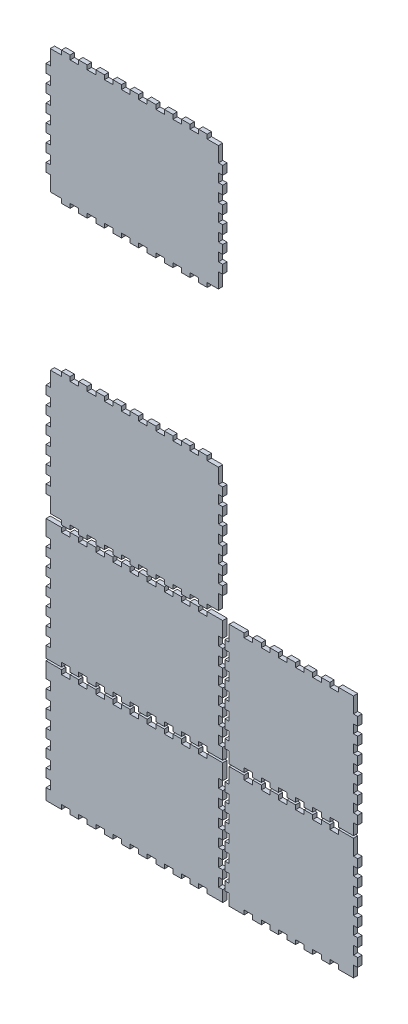
from build123d import *

# Parameters (mm, degrees)
P_IDAT_VYSUNUT_M1_DEPTH   = 4
P_IDAT_VYSUNUT_M1_2_DEPTH = 4
P_IDAT_VYSUNUT_M1_3_DEPTH = 4
P_IDAT_VYSUNUT_M1_4_DEPTH = 4
P_IDAT_VYSUNUT_M1_5_DEPTH = 4
P_IDAT_VYSUNUT_M1_6_DEPTH = 4


with BuildPart() as part:
    # Model → Přidat vysunutím1 (new body)
    with BuildSketch(Plane.XY):
        Polygon((13.9995, 22.0004), (24.5001, 22.0004), (24.5001, 25.9994), (32.4997, 25.9994), (32.4997, 22.0004), (40.5007, 22.0004), (40.5007, 25.9994), (48.4999, 25.9994), (48.4999, 22.0004), (56.4995, 22.0004), (56.4995, 25.9994), (64.5005, 25.9994), (64.5005, 22.0004), (72.5001, 22.0004), (72.5001, 25.9994), (80.4997, 25.9994), (80.4997, 22.0004), (88.5003, 22.0004), (88.5003, 25.9994), (96.4999, 25.9994), (96.4999, 22.0004), (104.499, 22.0004), (104.499, 25.9994), (112.5, 25.9994), (112.5, 22.0004), (120.5, 22.0004), (120.5, 25.9994), (128.501, 25.9994), (128.501, 22.0004), (136.5, 22.0004), (136.5, 25.9994), (144.5, 25.9994), (144.5, 22.0004), (152.499, 22.0004), (152.499, 25.9994), (160.5, 25.9994), (160.5, 22.0004), (171, 22.0004), (175, 22.0004), (175, 32.4997), (171, 32.4997), (171, 40.5007), (175, 40.5007), (175, 48.4999), (171, 48.4999), (171, 56.4995), (175, 56.4995), (175, 64.5005), (171, 64.5005), (171, 72.5001), (175, 72.5001), (175, 80.4997), (171, 80.4997), (171, 88.5003), (175, 88.5003), (175, 96.4999), (171, 96.4999), (171, 104.499), (175, 104.499), (175, 112.5), (171, 112.5), (171, 120.5), (175, 120.5), (175, 131), (175, 135), (171, 135), (160.5, 135), (160.5, 131), (152.499, 131), (152.499, 135), (144.5, 135), (144.5, 131), (136.5, 131), (136.5, 135), (128.501, 135), (128.501, 131), (120.5, 131), (120.5, 135), (112.5, 135), (112.5, 131), (104.499, 131), (104.499, 135), (96.4999, 135), (96.4999, 131), (88.5003, 131), (88.5003, 135), (80.4997, 135), (80.4997, 131), (72.5001, 131), (72.5001, 135), (64.5005, 135), (64.5005, 131), (56.4995, 131), (56.4995, 135), (48.4999, 135), (48.4999, 131), (40.5007, 131), (40.5007, 135), (32.4997, 135), (32.4997, 131), (24.5001, 131), (24.5001, 135), (13.9995, 135), (10.0004, 135), (10.0004, 131), (10.0004, 120.5), (13.9995, 120.5), (13.9995, 112.5), (10.0004, 112.5), (10.0004, 104.499), (13.9995, 104.499), (13.9995, 96.4999), (10.0004, 96.4999), (10.0004, 88.5003), (13.9995, 88.5003), (13.9995, 80.4997), (10.0004, 80.4997), (10.0004, 72.5001), (13.9995, 72.5001), (13.9995, 64.5005), (10.0004, 64.5005), (10.0004, 56.4995), (13.9995, 56.4995), (13.9995, 48.4999), (10.0004, 48.4999), (10.0004, 40.5007), (13.9995, 40.5007), (13.9995, 32.4997), (10.0004, 32.4997), (10.0004, 22.0004), align=None)
    extrude(amount=P_IDAT_VYSUNUT_M1_DEPTH)


with BuildPart() as body_2:
    # Model → P_idat vysunut_m1 2 (new body)
    with BuildSketch(Plane.XY):
        Polygon((13.9995, 137.001), (24.5001, 137.001), (24.5001, 141), (32.4997, 141), (32.4997, 137.001), (40.5007, 137.001), (40.5007, 141), (48.4999, 141), (48.4999, 137.001), (56.4995, 137.001), (56.4995, 141), (64.5005, 141), (64.5005, 137.001), (72.5001, 137.001), (72.5001, 141), (80.4997, 141), (80.4997, 137.001), (88.5003, 137.001), (88.5003, 141), (96.4999, 141), (96.4999, 137.001), (104.499, 137.001), (104.499, 141), (112.5, 141), (112.5, 137.001), (120.5, 137.001), (120.5, 141), (128.501, 141), (128.501, 137.001), (136.5, 137.001), (136.5, 141), (144.5, 141), (144.5, 137.001), (152.499, 137.001), (152.499, 141), (160.5, 141), (160.5, 137.001), (171, 137.001), (175, 137.001), (175, 147.5), (171, 147.5), (171, 155.499), (175, 155.499), (175, 163.5), (171, 163.5), (171, 171.5), (175, 171.5), (175, 179.5), (171, 179.5), (171, 187.5), (175, 187.5), (175, 195.5), (171, 195.5), (171, 203.501), (175, 203.501), (175, 211.5), (171, 211.5), (171, 219.499), (175, 219.499), (175, 227.5), (171, 227.5), (171, 235.5), (175, 235.5), (175, 246), (175, 249.999), (171, 249.999), (160.5, 249.999), (160.5, 246), (152.499, 246), (152.499, 249.999), (144.5, 249.999), (144.5, 246), (136.5, 246), (136.5, 249.999), (128.501, 249.999), (128.501, 246), (120.5, 246), (120.5, 249.999), (112.5, 249.999), (112.5, 246), (104.499, 246), (104.499, 249.999), (96.4999, 249.999), (96.4999, 246), (88.5003, 246), (88.5003, 249.999), (80.4997, 249.999), (80.4997, 246), (72.5001, 246), (72.5001, 249.999), (64.5005, 249.999), (64.5005, 246), (56.4995, 246), (56.4995, 249.999), (48.4999, 249.999), (48.4999, 246), (40.5007, 246), (40.5007, 249.999), (32.4997, 249.999), (32.4997, 246), (24.5001, 246), (24.5001, 249.999), (13.9995, 249.999), (10.0004, 249.999), (10.0004, 246), (10.0004, 235.5), (13.9995, 235.5), (13.9995, 227.5), (10.0004, 227.5), (10.0004, 219.499), (13.9995, 219.499), (13.9995, 211.5), (10.0004, 211.5), (10.0004, 203.501), (13.9995, 203.501), (13.9995, 195.5), (10.0004, 195.5), (10.0004, 187.5), (13.9995, 187.5), (13.9995, 179.5), (10.0004, 179.5), (10.0004, 171.5), (13.9995, 171.5), (13.9995, 163.5), (10.0004, 163.5), (10.0004, 155.499), (13.9995, 155.499), (13.9995, 147.5), (10.0004, 147.5), (10.0004, 137.001), align=None)
    extrude(amount=P_IDAT_VYSUNUT_M1_2_DEPTH)


with BuildPart() as body_3:
    # Model → P_idat vysunut_m1 3 (new body)
    with BuildSketch(Plane.XY):
        Polygon((13.9995, 256), (24.5001, 256), (24.5001, 252), (32.4997, 252), (32.4997, 256), (40.5007, 256), (40.5007, 252), (48.4999, 252), (48.4999, 256), (56.4995, 256), (56.4995, 252), (64.5005, 252), (64.5005, 256), (72.5001, 256), (72.5001, 252), (80.4997, 252), (80.4997, 256), (88.5003, 256), (88.5003, 252), (96.4999, 252), (96.4999, 256), (104.499, 256), (104.499, 252), (112.5, 252), (112.5, 256), (120.5, 256), (120.5, 252), (128.501, 252), (128.501, 256), (136.5, 256), (136.5, 252), (144.5, 252), (144.5, 256), (152.499, 256), (152.499, 252), (160.5, 252), (160.5, 256), (171, 256), (171, 270), (175, 270), (175, 278), (171, 278), (171, 285.999), (175, 285.999), (175, 294), (171, 294), (171, 302), (175, 302), (175, 309.999), (171, 309.999), (171, 318), (175, 318), (175, 326), (171, 326), (171, 334), (175, 334), (175, 342), (171, 342), (171, 350), (175, 350), (175, 357.999), (171, 357.999), (171, 372.001), (160.5, 372.001), (160.5, 376.001), (152.499, 376.001), (152.499, 372.001), (144.5, 372.001), (144.5, 376.001), (136.5, 376.001), (136.5, 372.001), (128.501, 372.001), (128.501, 376.001), (120.5, 376.001), (120.5, 372.001), (112.5, 372.001), (112.5, 376.001), (104.499, 376.001), (104.499, 372.001), (96.4999, 372.001), (96.4999, 376.001), (88.5003, 376.001), (88.5003, 372.001), (80.4997, 372.001), (80.4997, 376.001), (72.5001, 376.001), (72.5001, 372.001), (64.5005, 372.001), (64.5005, 376.001), (56.4995, 376.001), (56.4995, 372.001), (48.4999, 372.001), (48.4999, 376.001), (40.5007, 376.001), (40.5007, 372.001), (32.4997, 372.001), (32.4997, 376.001), (24.5001, 376.001), (24.5001, 372.001), (13.9995, 372.001), (13.9995, 357.999), (10.0004, 357.999), (10.0004, 350), (13.9995, 350), (13.9995, 342), (10.0004, 342), (10.0004, 334), (13.9995, 334), (13.9995, 326), (10.0004, 326), (10.0004, 318), (13.9995, 318), (13.9995, 309.999), (10.0004, 309.999), (10.0004, 302), (13.9995, 302), (13.9995, 294), (10.0004, 294), (10.0004, 285.999), (13.9995, 285.999), (13.9995, 278), (10.0004, 278), (10.0004, 270), (13.9995, 270), align=None)
    extrude(amount=P_IDAT_VYSUNUT_M1_3_DEPTH)


with BuildPart() as body_4:
    # Model → P_idat vysunut_m1 4 (new body)
    with BuildSketch(Plane.XY):
        Polygon((13.9995, 516.001), (24.5001, 516.001), (24.5001, 512), (32.4997, 512), (32.4997, 516.001), (40.5007, 516.001), (40.5007, 512), (48.4999, 512), (48.4999, 516.001), (56.4995, 516.001), (56.4995, 512), (64.5005, 512), (64.5005, 516.001), (72.5001, 516.001), (72.5001, 512), (80.4997, 512), (80.4997, 516.001), (88.5003, 516.001), (88.5003, 512), (96.4999, 512), (96.4999, 516.001), (104.499, 516.001), (104.499, 512), (112.5, 512), (112.5, 516.001), (120.5, 516.001), (120.5, 512), (128.501, 512), (128.501, 516.001), (136.5, 516.001), (136.5, 512), (144.5, 512), (144.5, 516.001), (152.499, 516.001), (152.499, 512), (160.5, 512), (160.5, 516.001), (171, 516.001), (171, 529.999), (175, 529.999), (175, 538), (171, 538), (171, 546.001), (175, 546.001), (175, 553.999), (171, 553.999), (171, 562), (175, 562), (175, 570.001), (171, 570.001), (171, 578.002), (175, 578.002), (175, 585.999), (171, 585.999), (171, 594), (175, 594), (175, 602.001), (171, 602.001), (171, 609.999), (175, 609.999), (175, 618), (171, 618), (171, 632.001), (160.5, 632.001), (160.5, 636.002), (152.499, 636.002), (152.499, 632.001), (144.5, 632.001), (144.5, 636.002), (136.5, 636.002), (136.5, 632.001), (128.501, 632.001), (128.501, 636.002), (120.5, 636.002), (120.5, 632.001), (112.5, 632.001), (112.5, 636.002), (104.499, 636.002), (104.499, 632.001), (96.4999, 632.001), (96.4999, 636.002), (88.5003, 636.002), (88.5003, 632.001), (80.4997, 632.001), (80.4997, 636.002), (72.5001, 636.002), (72.5001, 632.001), (64.5005, 632.001), (64.5005, 636.002), (56.4995, 636.002), (56.4995, 632.001), (48.4999, 632.001), (48.4999, 636.002), (40.5007, 636.002), (40.5007, 632.001), (32.4997, 632.001), (32.4997, 636.002), (24.5001, 636.002), (24.5001, 632.001), (13.9995, 632.001), (13.9995, 618), (10.0004, 618), (10.0004, 609.999), (13.9995, 609.999), (13.9995, 602.001), (10.0004, 602.001), (10.0004, 594), (13.9995, 594), (13.9995, 585.999), (10.0004, 585.999), (10.0004, 578.002), (13.9995, 578.002), (13.9995, 570.001), (10.0004, 570.001), (10.0004, 562), (13.9995, 562), (13.9995, 553.999), (10.0004, 553.999), (10.0004, 546.001), (13.9995, 546.001), (13.9995, 538), (10.0004, 538), (10.0004, 529.999), (13.9995, 529.999), align=None)
    extrude(amount=P_IDAT_VYSUNUT_M1_4_DEPTH)


with BuildPart() as body_5:
    # Model → P_idat vysunut_m1 5 (new body)
    with BuildSketch(Plane.XY):
        Polygon((181, 22.0004), (195.001, 22.0004), (195.001, 25.9994), (203, 25.9994), (203, 22.0004), (211, 22.0004), (211, 25.9994), (218.999, 25.9994), (218.999, 22.0004), (227, 22.0004), (227, 25.9994), (235, 25.9994), (235, 22.0004), (243, 22.0004), (243, 25.9994), (251, 25.9994), (251, 22.0004), (259, 22.0004), (259, 25.9994), (267.001, 25.9994), (267.001, 22.0004), (275, 22.0004), (275, 25.9994), (282.999, 25.9994), (282.999, 22.0004), (297, 22.0004), (297, 32.4997), (301, 32.4997), (301, 40.5007), (297, 40.5007), (297, 48.4999), (301, 48.4999), (301, 56.4995), (297, 56.4995), (297, 64.5005), (301, 64.5005), (301, 72.5001), (297, 72.5001), (297, 80.4997), (301, 80.4997), (301, 88.5003), (297, 88.5003), (297, 96.4999), (301, 96.4999), (301, 104.499), (297, 104.499), (297, 112.5), (301, 112.5), (301, 120.5), (297, 120.5), (297, 131), (297, 135), (282.999, 135), (282.999, 131), (275, 131), (275, 135), (267.001, 135), (267.001, 131), (259, 131), (259, 135), (251, 135), (251, 131), (243, 131), (243, 135), (235, 135), (235, 131), (227, 131), (227, 135), (218.999, 135), (218.999, 131), (211, 131), (211, 135), (203, 135), (203, 131), (195.001, 131), (195.001, 135), (181, 135), (181, 131), (181, 120.5), (176.999, 120.5), (176.999, 112.5), (181, 112.5), (181, 104.499), (176.999, 104.499), (176.999, 96.4999), (181, 96.4999), (181, 88.5003), (176.999, 88.5003), (176.999, 80.4997), (181, 80.4997), (181, 72.5001), (176.999, 72.5001), (176.999, 64.5005), (181, 64.5005), (181, 56.4995), (176.999, 56.4995), (176.999, 48.4999), (181, 48.4999), (181, 40.5007), (176.999, 40.5007), (176.999, 32.4997), (181, 32.4997), align=None)
    extrude(amount=P_IDAT_VYSUNUT_M1_5_DEPTH)


with BuildPart() as body_6:
    # Model → P_idat vysunut_m1 6 (new body)
    with BuildSketch(Plane.XY):
        Polygon((181, 137.001), (195.001, 137.001), (195.001, 141), (203, 141), (203, 137.001), (211, 137.001), (211, 141), (218.999, 141), (218.999, 137.001), (227, 137.001), (227, 141), (235, 141), (235, 137.001), (243, 137.001), (243, 141), (251, 141), (251, 137.001), (259, 137.001), (259, 141), (267.001, 141), (267.001, 137.001), (275, 137.001), (275, 141), (282.999, 141), (282.999, 137.001), (297, 137.001), (297, 147.5), (301, 147.5), (301, 155.499), (297, 155.499), (297, 163.5), (301, 163.5), (301, 171.5), (297, 171.5), (297, 179.5), (301, 179.5), (301, 187.5), (297, 187.5), (297, 195.5), (301, 195.5), (301, 203.501), (297, 203.501), (297, 211.5), (301, 211.5), (301, 219.499), (297, 219.499), (297, 227.5), (301, 227.5), (301, 235.5), (297, 235.5), (297, 246), (297, 249.999), (282.999, 249.999), (282.999, 246), (275, 246), (275, 249.999), (267.001, 249.999), (267.001, 246), (259, 246), (259, 249.999), (251, 249.999), (251, 246), (243, 246), (243, 249.999), (235, 249.999), (235, 246), (227, 246), (227, 249.999), (218.999, 249.999), (218.999, 246), (211, 246), (211, 249.999), (203, 249.999), (203, 246), (195.001, 246), (195.001, 249.999), (181, 249.999), (181, 246), (181, 235.5), (176.999, 235.5), (176.999, 227.5), (181, 227.5), (181, 219.499), (176.999, 219.499), (176.999, 211.5), (181, 211.5), (181, 203.501), (176.999, 203.501), (176.999, 195.5), (181, 195.5), (181, 187.5), (176.999, 187.5), (176.999, 179.5), (181, 179.5), (181, 171.5), (176.999, 171.5), (176.999, 163.5), (181, 163.5), (181, 155.499), (176.999, 155.499), (176.999, 147.5), (181, 147.5), align=None)
    extrude(amount=P_IDAT_VYSUNUT_M1_6_DEPTH)


solid = Compound([part.part, body_2.part, body_3.part, body_4.part, body_5.part, body_6.part])
